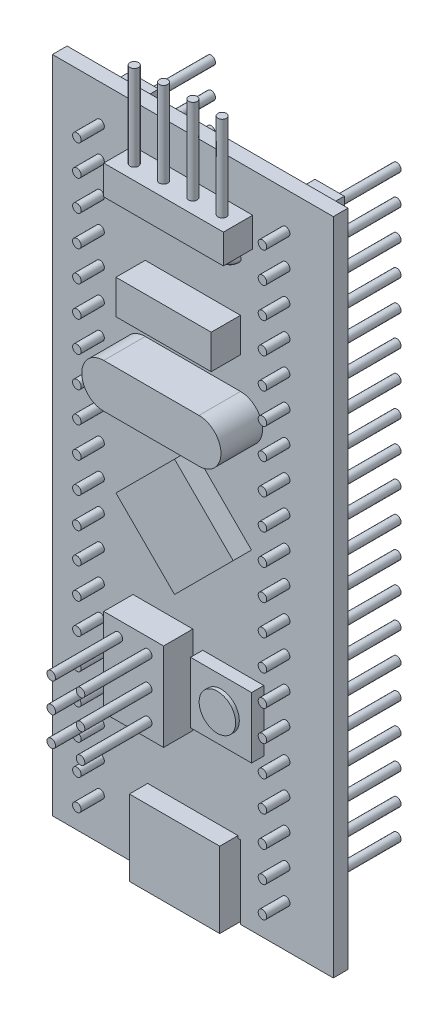
from build123d import *

# Parameters (mm, degrees)
SKETCH_1_W               = 23
SKETCH_1_H               = 54
PCB_DEPTH                = 1.2
SKETCH_2_W               = 2.4
SKETCH_2_H               = 50.6
GPIO_PIN_BLOCKS_DEPTH    = 2.4
SKETCH_3_R               = 0.35
GPIO_PINS_DEPTH          = 5.5
SKETCH_4_W               = 9.8
SKETCH_4_H               = 2.4
SKETCH_4_W_2             = 4.9
SKETCH_4_H_2             = 7.2
SKETCH_4_W_3             = 7.8
SKETCH_4_H_3             = 2.8
BOOT_JUMPER_BLOCK_DEPTH  = 2.4
SKETCH_7_R               = 0.35
BOOT_JUMPER_PINS_DEPTH   = 5.5
SKETCH_5_R               = 0.35
ST_LINK_PINS_DEPTH       = 7
SKETCH_6_R               = 0.35
SKETCH_8_W               = 7.4
SKETCH_8_H               = 6.2
STM32_CHIP_DEPTH         = 1.5
CRYSTAL_OSCILLATOR_DEPTH = 3.4
SKETCH_10_W              = 5
SKETCH_10_H              = 5
RESET_BUTTON_BASE_DEPTH  = 1
SKETCH_11_R              = 1.495071924
RESET_BUTTON_DEPTH       = 0.3
MICRO_USB_PORT_DEPTH     = 6
IZIM1_W                  = 6.9
IZIM1_H                  = 1
MICRO_USB_PORT_CUT_DEPTH = 5


with BuildPart() as part:
    # Эскиз1 → PCB (new body)
    with BuildSketch(Plane.XY):
        with Locations((0.400091461, -3.870786517)):
            Rectangle(SKETCH_1_W, SKETCH_1_H)
    extrude(amount=PCB_DEPTH)

    # Эскиз2 → GPIO Pin Blocks (add)
    with BuildSketch(Plane(origin=(0, 0, 0), x_dir=(-1, 0, 0), z_dir=(0, 0, -1))):
        with Locations((-8.000091461, -3.870786517)):
            Rectangle(SKETCH_2_W, SKETCH_2_H)
        with Locations((7.199908539, -3.870786517)):
            Rectangle(SKETCH_2_W, SKETCH_2_H)
    extrude(amount=GPIO_PIN_BLOCKS_DEPTH)

    # Эскиз3 → GPIO Pins (add, symmetric)
    with BuildSketch(Plane(origin=(0, 0, -2.4), x_dir=(-1, 0, 0), z_dir=(0, 0, -1))):
        with Locations((-8.000091461, 20.132856753)):
            Circle(SKETCH_3_R)
        with Locations((7.199908539, 20.132856753)):
            Circle(SKETCH_3_R)
        with Locations((7.199908539, 17.632856753)):
            Circle(SKETCH_3_R)
        with Locations((7.199908539, 15.132856753)):
            Circle(SKETCH_3_R)
        with Locations((7.199908539, 12.632856753)):
            Circle(SKETCH_3_R)
        with Locations((7.199908539, 10.132856753)):
            Circle(SKETCH_3_R)
        with Locations((7.199908539, 7.632856753)):
            Circle(SKETCH_3_R)
        with Locations((7.199908539, 5.132856753)):
            Circle(SKETCH_3_R)
        with Locations((7.199908539, 2.632856753)):
            Circle(SKETCH_3_R)
        with Locations((7.199908539, 0.132856753)):
            Circle(SKETCH_3_R)
        with Locations((7.199908539, -2.367143247)):
            Circle(SKETCH_3_R)
        with Locations((7.199908539, -4.867143247)):
            Circle(SKETCH_3_R)
        with Locations((7.199908539, -7.367143247)):
            Circle(SKETCH_3_R)
        with Locations((7.199908539, -9.867143247)):
            Circle(SKETCH_3_R)
        with Locations((7.199908539, -12.367143247)):
            Circle(SKETCH_3_R)
        with Locations((7.199908539, -14.867143247)):
            Circle(SKETCH_3_R)
        with Locations((7.199908539, -17.367143247)):
            Circle(SKETCH_3_R)
        with Locations((7.199908539, -19.867143247)):
            Circle(SKETCH_3_R)
        with Locations((7.199908539, -22.367143247)):
            Circle(SKETCH_3_R)
        with Locations((7.199908539, -24.867143247)):
            Circle(SKETCH_3_R)
        with Locations((7.199908539, -27.367143247)):
            Circle(SKETCH_3_R)
        with Locations((-8.000091461, 17.632856753)):
            Circle(SKETCH_3_R)
        with Locations((-8.000091461, 15.132856753)):
            Circle(SKETCH_3_R)
        with Locations((-8.000091461, 12.632856753)):
            Circle(SKETCH_3_R)
        with Locations((-8.000091461, 10.132856753)):
            Circle(SKETCH_3_R)
        with Locations((-8.000091461, 7.632856753)):
            Circle(SKETCH_3_R)
        with Locations((-8.000091461, 5.132856753)):
            Circle(SKETCH_3_R)
        with Locations((-8.000091461, 2.632856753)):
            Circle(SKETCH_3_R)
        with Locations((-8.000091461, 0.132856753)):
            Circle(SKETCH_3_R)
        with Locations((-8.000091461, -2.367143247)):
            Circle(SKETCH_3_R)
        with Locations((-8.000091461, -4.867143247)):
            Circle(SKETCH_3_R)
        with Locations((-8.000091461, -7.367143247)):
            Circle(SKETCH_3_R)
        with Locations((-8.000091461, -9.867143247)):
            Circle(SKETCH_3_R)
        with Locations((-8.000091461, -12.367143247)):
            Circle(SKETCH_3_R)
        with Locations((-8.000091461, -14.867143247)):
            Circle(SKETCH_3_R)
        with Locations((-8.000091461, -17.367143247)):
            Circle(SKETCH_3_R)
        with Locations((-8.000091461, -19.867143247)):
            Circle(SKETCH_3_R)
        with Locations((-8.000091461, -22.367143247)):
            Circle(SKETCH_3_R)
        with Locations((-8.000091461, -24.867143247)):
            Circle(SKETCH_3_R)
        with Locations((-8.000091461, -27.367143247)):
            Circle(SKETCH_3_R)
    extrude(amount=GPIO_PINS_DEPTH, both=True)

    # Эскиз4 → Boot Jumper Block (add)
    with BuildSketch(Plane.XY.offset(1.2)):
        with Locations((0.400091461, 18.729213483)):
            Rectangle(SKETCH_4_W, SKETCH_4_H)
        with Locations((-2.049908539, -15.470786517)):
            Rectangle(SKETCH_4_W_2, SKETCH_4_H_2)
        with Locations((0.400091461, 10.929213483)):
            Rectangle(SKETCH_4_W_3, SKETCH_4_H_3)
    extrude(amount=BOOT_JUMPER_BLOCK_DEPTH)

    # Эскиз7 → Boot Jumper Pins (add, symmetric)
    with BuildSketch(Plane.XY.offset(3.6)):
        with Locations((-3.299908539, -13.070786517)):
            Circle(SKETCH_7_R)
        with Locations((-0.899908539, -13.070786517)):
            Circle(SKETCH_7_R)
        with Locations((-0.899908539, -15.470786517)):
            Circle(SKETCH_7_R)
        with Locations((-0.899908539, -17.870786517)):
            Circle(SKETCH_7_R)
        with Locations((-3.299908539, -15.470786517)):
            Circle(SKETCH_7_R)
        with Locations((-3.299908539, -17.870786517)):
            Circle(SKETCH_7_R)
    extrude(amount=BOOT_JUMPER_PINS_DEPTH, both=True)

    # Эскиз5 → ST Link Pins (add)
    with BuildSketch(Plane(origin=(0, 19.929213483, 0), x_dir=(1, 0, 0), z_dir=(0, 1, 0))):
        with Locations((-3.199908539, -2.4)):
            Circle(SKETCH_5_R)
        with Locations((-0.799908539, -2.4)):
            Circle(SKETCH_5_R)
        with Locations((1.600091461, -2.4)):
            Circle(SKETCH_5_R)
        with Locations((4.000091461, -2.4)):
            Circle(SKETCH_5_R)
    extrude(amount=ST_LINK_PINS_DEPTH)

    # Эскиз6 → 90 Degree ST Link Pins (revolve)
    with BuildSketch(Plane.XZ.offset(-17.529213483), mode=Mode.PRIVATE) as f_90_degree_st_link_pins_sk:
        with Locations((-3.199908539, 2.4)):
            Circle(SKETCH_6_R)
        with Locations((-0.799908539, 2.4)):
            Circle(SKETCH_6_R)
        with Locations((1.600091461, 2.4)):
            Circle(SKETCH_6_R)
        with Locations((4.000091461, 2.4)):
            Circle(SKETCH_6_R)
    revolve(f_90_degree_st_link_pins_sk.sketch.rotate(Axis((-4.499908539, 17.529213483, 1.2), (1, 0, 0)), 45), axis=Axis((-4.499908539, 17.529213483, 1.2), (1, 0, 0)))

    # Эскиз8 → STM32 Chip (add)
    with BuildSketch(Plane.XY.offset(1.2)):
        Polygon((-4.399908539, -3.870786517), (0.400091461, 0.929213483), (5.200091461, -3.870786517), (0.400091461, -8.670786517), align=None)
        with Locations((0.400091461, -27.770786517)):
            Rectangle(SKETCH_8_W, SKETCH_8_H)
    extrude(amount=STM32_CHIP_DEPTH)

    # Эскиз9 → Crystal Oscillator (add)
    with BuildSketch(Plane.XY.offset(1.2)):
        with BuildLine():
            Line((-3.499908539, 6.929213483), (4.300091461, 6.929213483))
            ThreePointArc((4.300091461, 6.929213483), (6.100091461, 5.129213483), (4.300091461, 3.329213483))
            Line((4.300091461, 3.329213483), (-3.499908539, 3.329213483))
            ThreePointArc((-3.499908539, 3.329213483), (-5.299908539, 5.129213483), (-3.499908539, 6.929213483))
        make_face()
    extrude(amount=CRYSTAL_OSCILLATOR_DEPTH)

    # Эскиз10 → Reset Button Base (add)
    with BuildSketch(Plane.XY.offset(1.2)):
        with Locations((3.709299321, -15.470786517)):
            Rectangle(SKETCH_10_W, SKETCH_10_H)
    extrude(amount=RESET_BUTTON_BASE_DEPTH)

    # Эскиз11 → Reset Button (add)
    with BuildSketch(Plane.XY.offset(2.2)):
        with Locations((3.709299321, -15.470786517)):
            Circle(SKETCH_11_R)
    extrude(amount=RESET_BUTTON_DEPTH)

    # Эскиз12 → Micro USB Port (cut)
    with BuildSketch(Plane.XZ.offset(30.870786517)):
        Polygon((-3.48398033, 1.2), (-3.48398033, 0), (4.284163251, 0), (4.284163251, 1.2), (4.100091461, 1.2), (4.100091461, 0.727005887), (3.520830502, 0.185516694), (-2.720647581, 0.185516694), (-3.299908539, 0.727005887), (-3.299908539, 1.2), align=None)
    extrude(amount=-MICRO_USB_PORT_DEPTH, mode=Mode.SUBTRACT)

    # Çizim1 → Micro USB Port Cut (cut)
    with BuildSketch(Plane.XZ.offset(30.870786517)):
        Polygon((-3.049908539, 0.985516694), (-2.533402927, 0.485516694), (3.333585849, 0.485516694), (3.850091461, 0.985516694), align=None)
        with Locations((0.400091461, 1.885516694)):
            Rectangle(IZIM1_W, IZIM1_H)
    extrude(amount=-MICRO_USB_PORT_CUT_DEPTH, mode=Mode.SUBTRACT)


solid = part.part
